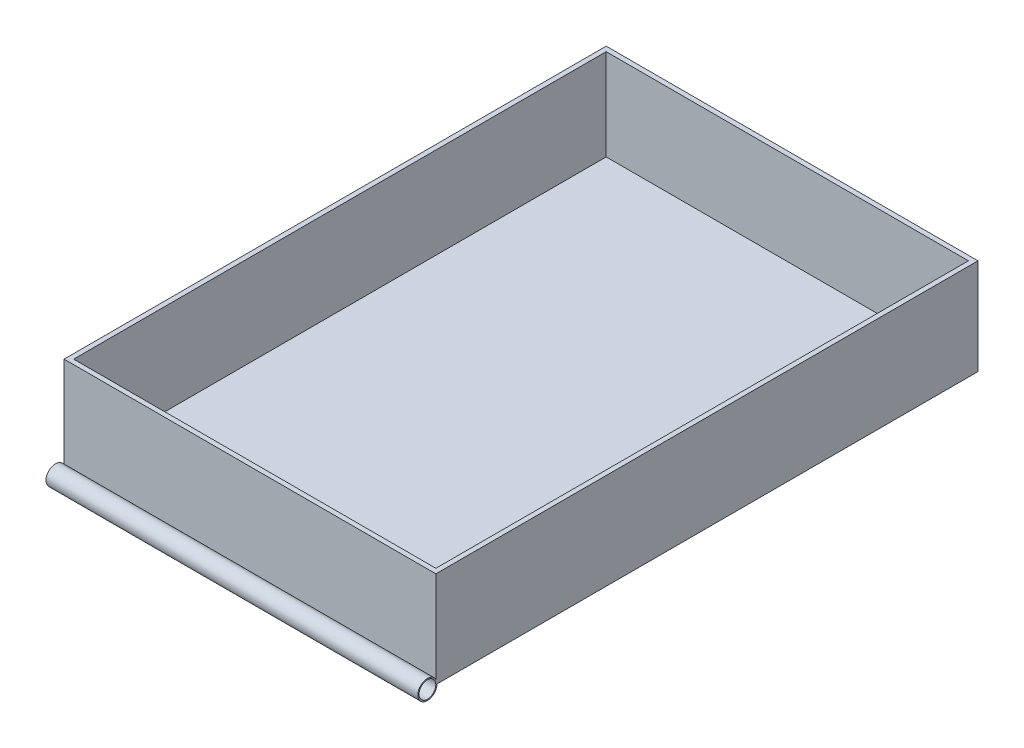
from build123d import *

# Parameters (mm, degrees)
SKETCH1_W           = 775
SKETCH1_H           = 1130
BOSS_EXTRUDE1_DEPTH = 200
SHELL1_T            = -10
SKETCH4_R           = 20
BOSS_EXTRUDE3_DEPTH = 775
SKETCH5_R           = 17.5
CUT_EXTRUDE2_DEPTH  = 1280


with BuildPart() as part:
    # Sketch1 → Boss-Extrude1 (new body)
    with BuildSketch(Plane(origin=(0, 0, 0), x_dir=(1, 0, 0), z_dir=(0, 1, 0))):
        Rectangle(SKETCH1_W, SKETCH1_H)
    extrude(amount=BOSS_EXTRUDE1_DEPTH)

    # Shell1
    shell1_openings = [part.faces().sort_by_distance(p)[0] for p in [
        (0, 200, 0),
    ]]
    offset(amount=SHELL1_T, openings=shell1_openings, kind=Kind.INTERSECTION)

    # Sketch4 → Boss-Extrude3 (add)
    with BuildSketch(Plane(origin=(387.5, 0, 0), x_dir=(0, 0, -1), z_dir=(1, 0, 0))):
        with Locations((-582.66692, 0)):
            Circle(SKETCH4_R)
    extrude(amount=-BOSS_EXTRUDE3_DEPTH)

    # Sketch5 → Cut-Extrude2 (cut)
    with BuildSketch(Plane(origin=(387.5, 0, 0), x_dir=(0, 0, -1), z_dir=(1, 0, 0))):
        with Locations((-582.66692, 0)):
            Circle(SKETCH5_R)
    extrude(amount=-CUT_EXTRUDE2_DEPTH, mode=Mode.SUBTRACT)


solid = part.part
